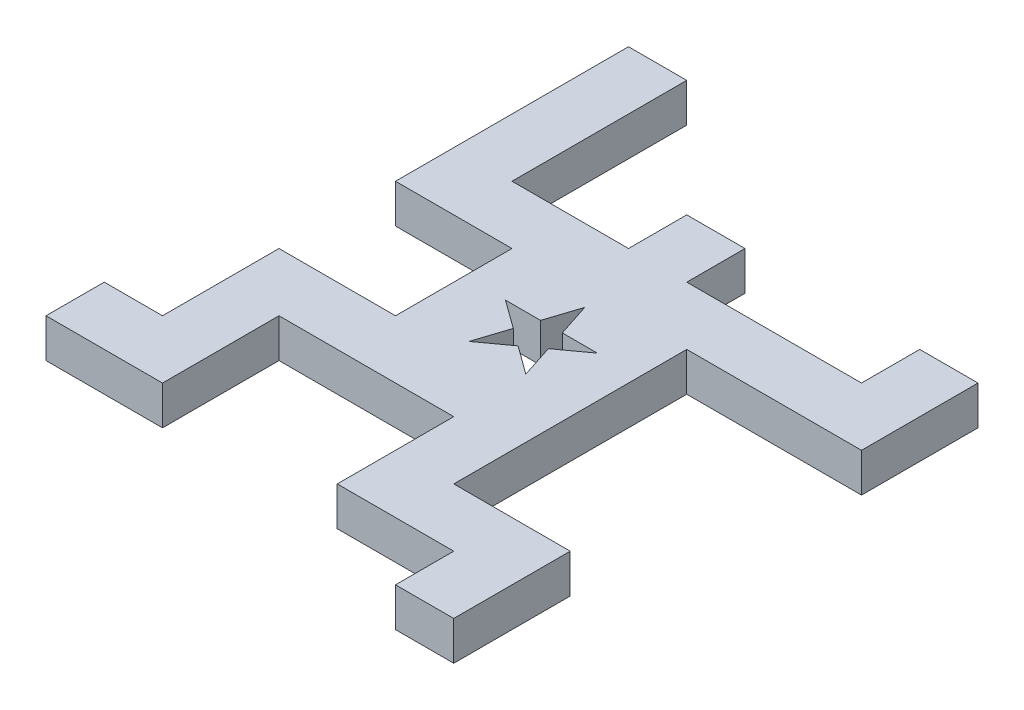
from build123d import *

# Parameters (mm, degrees)
SKETCH1_W           = 22.5
SKETCH1_H           = 30
SKETCH1_W_2         = 7.5
SKETCH1_H_2         = 7.5
BOSS_EXTRUDE1_DEPTH = 5
CUT_EXTRUDE1_DEPTH  = 51.698249477


with BuildPart() as part:
    # Sketch1 → Boss-Extrude1 (new body)
    with BuildSketch(Plane(origin=(0, 0, 0), x_dir=(1, 0, 0), z_dir=(0, 1, 0))):
        Polygon((-11.25, 7.5), (-11.25, 15), (-18.75, 15), (-18.75, 37.5), (-26.25, 37.5), (-26.25, 7.5), align=None)
        Rectangle(SKETCH1_W, SKETCH1_H)
        with Locations((0, 18.75)):
            Rectangle(SKETCH1_W_2, SKETCH1_H_2)
        Polygon((26.25, 15), (11.25, 15), (11.25, 7.5), (33.75, 7.5), (33.75, 22.5), (26.25, 22.5), align=None)
        Polygon((11.25, -22.5), (11.25, -15), (3.75, -15), (3.75, -30), (18.75, -30), (18.75, -37.5), (26.25, -37.5), (26.25, -22.5), align=None)
        Polygon((-18.75, -15), (-11.25, -15), (-11.25, -7.5), (-26.25, -7.5), (-26.25, -22.5), (-33.75, -22.5), (-33.75, -30), (-18.75, -30), align=None)
    extrude(amount=BOSS_EXTRUDE1_DEPTH)

    # Sketch2 → Cut-Extrude1 (cut, through all)
    with BuildSketch(Plane(origin=(0, 5, 0), x_dir=(1, 0, 0), z_dir=(0, 1, 0))):
        Polygon((0, 5.625), (-1.396218154, 1.327882373), (-5.914475011, 1.327882373), (-2.259128429, -1.327882373), (-3.655346583, -5.625), (0, -2.969235253), (3.655346583, -5.625), (2.259128429, -1.327882373), (5.914475011, 1.327882373), (1.396218154, 1.327882373), align=None)
    extrude(amount=-CUT_EXTRUDE1_DEPTH, mode=Mode.SUBTRACT)


solid = part.part
